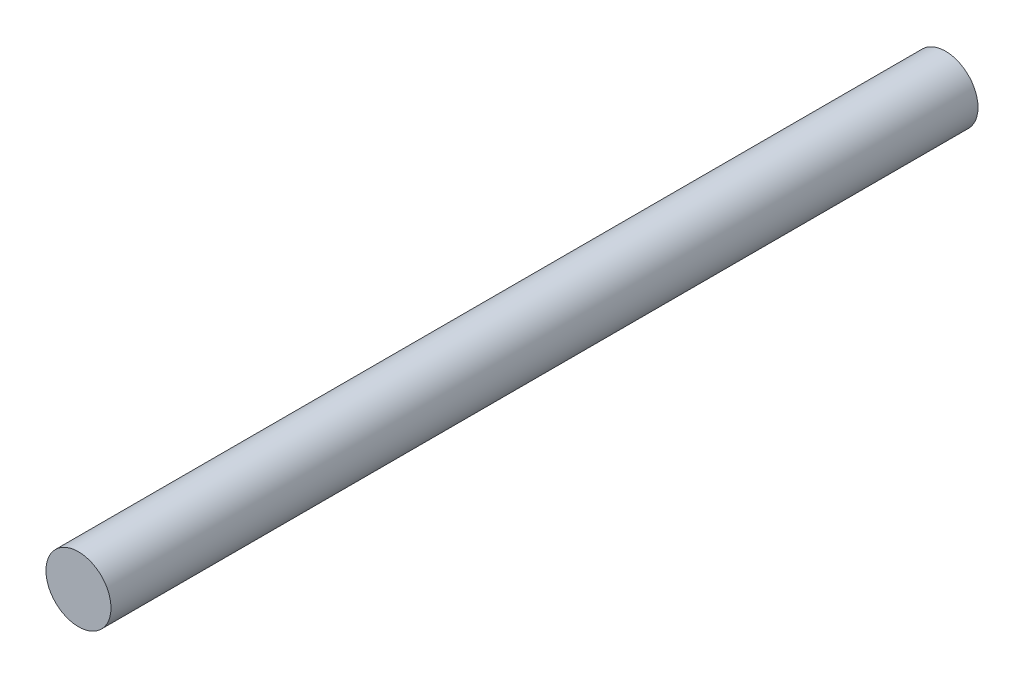
from build123d import *

# Parameters (mm, degrees)
SKETCH1_R           = 4.7625
BOSS_EXTRUDE1_DEPTH = 127


with BuildPart() as part:
    # Sketch1 → Boss-Extrude1 (new body)
    with BuildSketch(Plane.XY):
        Circle(SKETCH1_R)
    extrude(amount=BOSS_EXTRUDE1_DEPTH)


solid = part.part
